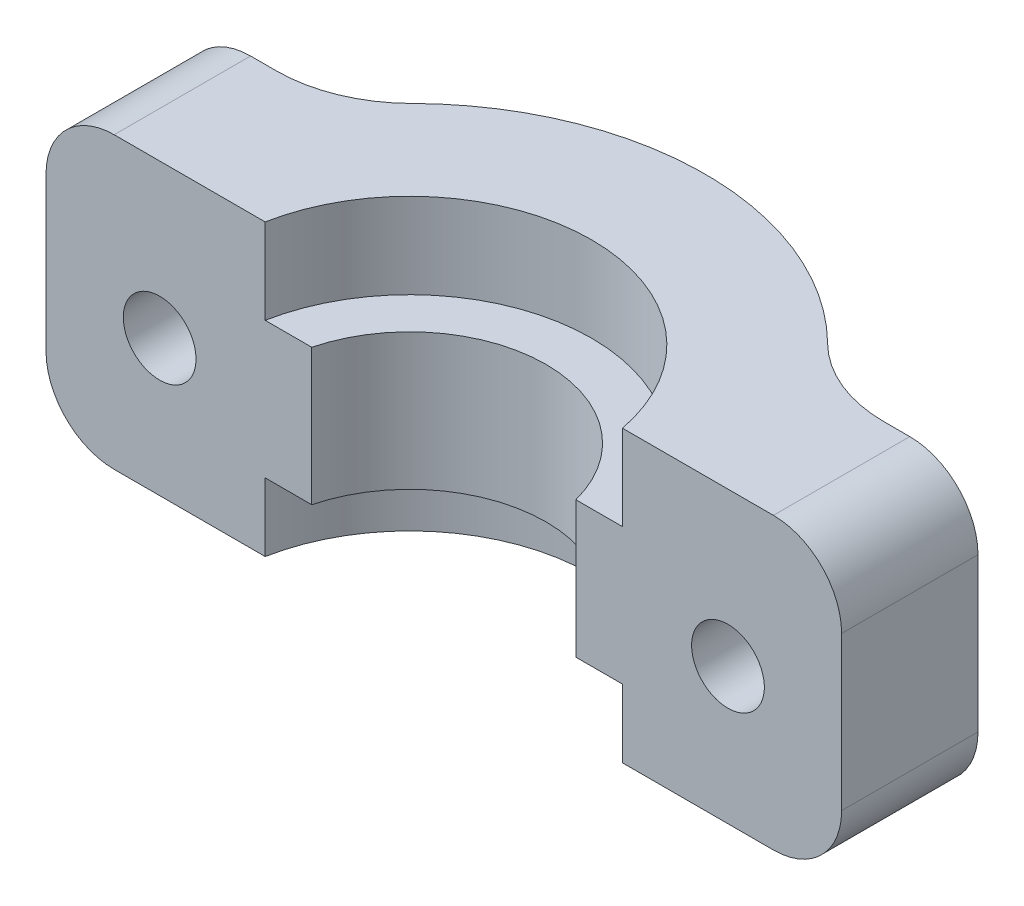
from build123d import *

# Parameters (mm, degrees)
BOSS_EXTRUDE1_DEPTH = 22
BOSS_EXTRUDE2_DEPTH = 22
SKETCH5_R           = 8
CUT_EXTRUDE5_DEPTH  = 3
CUT_EXTRUDE6_START  = -13
SKETCH6_R           = 8
CUT_EXTRUDE6_DEPTH  = 13
SKETCH8_R           = 2.55
CUT_EXTRUDE7_DEPTH  = 7
SKETCH7_W           = 44
SKETCH7_H           = 29.325472949
CUT_EXTRUDE8_DEPTH  = 9.25
FILLET1_R           = 6
SKETCH10_R          = 3.25
CUT_EXTRUDE9_DEPTH  = 58.619441164
SKETCH11_R          = 1.6
CUT_EXTRUDE10_DEPTH = 6
FILLET3_R           = 3


with BuildPart() as part:
    # Sketch2 → Boss-Extrude1 (new body)
    with BuildSketch(Plane(origin=(0, 0, 0), x_dir=(1, 0, 0), z_dir=(0, 1, 0))):
        with BuildLine():
            Line((0, 0), (44, 0))
            Line((44, 0), (44, 22.5))
            Line((44, 22.5), (23.5, 22.5))
            ThreePointArc((23.5, 22.5), (17.5, 16.5), (11.5, 22.5))
            Line((11.5, 22.5), (0, 22.5))
            Line((0, 22.5), (0, 0))
        make_face()
    extrude(amount=BOSS_EXTRUDE1_DEPTH)


with BuildPart() as body_2:
    # Sketch9 → Boss-Extrude2 (new body)
    with BuildSketch(Plane.XZ):
        with BuildLine():
            Line((11.690524981, -24), (0, -24))
            Line((0, -24), (0, -30))
            Line((0, -30), (6.881619709, -30))
            ThreePointArc((6.881619709, -30), (17.5, -35.5), (28.118380291, -30))
            Line((28.118380291, -30), (35, -30))
            Line((35, -30), (35, -24))
            Line((35, -24), (23.309475019, -24))
            ThreePointArc((23.309475019, -24), (17.5, -28.5), (11.690524981, -24))
        make_face()
    extrude(amount=-BOSS_EXTRUDE2_DEPTH)


with BuildPart() as cut_extrude5_tool:
    # Sketch5 → Cut-Extrude5 (new body)
    with BuildSketch(Plane.XZ):
        with Locations((17.5, -22.5)):
            Circle(SKETCH5_R)
    extrude(amount=-CUT_EXTRUDE5_DEPTH)


with BuildPart() as part_1:
    add(part.part)

    # Cut-Extrude5: cut by cut_extrude5_tool
    add(cut_extrude5_tool.part, mode=Mode.SUBTRACT)


with BuildPart() as body_2_1:
    add(body_2.part)

    # Cut-Extrude5: cut by cut_extrude5_tool
    add(cut_extrude5_tool.part, mode=Mode.SUBTRACT)


with BuildPart() as cut_extrude6_tool:
    # Sketch6 → Cut-Extrude6 (new body)
    with BuildSketch(Plane(origin=(0, 22, 0), x_dir=(1, 0, 0), z_dir=(0, 1, 0)).offset(CUT_EXTRUDE6_START)):
        with Locations((17.5, 22.5)):
            Circle(SKETCH6_R)
    extrude(amount=CUT_EXTRUDE6_DEPTH)


with BuildPart() as part_2:
    add(part_1.part)

    # Cut-Extrude6: cut by cut_extrude6_tool
    add(cut_extrude6_tool.part, mode=Mode.SUBTRACT)

    # Sketch8 → Cut-Extrude7 (cut)
    with BuildSketch(Plane(origin=(0, 0, -22.5), x_dir=(-1, 0, 0), z_dir=(0, 0, -1))):
        with Locations((-5, 6)):
            Circle(SKETCH8_R)
        with Locations(Location((-30, 6, 0), (0, 0, 180))):
            Circle(SKETCH8_R)
    extrude(amount=-CUT_EXTRUDE7_DEPTH, mode=Mode.SUBTRACT)


with BuildPart() as body_2_2:
    add(body_2_1.part)

    # Cut-Extrude6: cut by cut_extrude6_tool
    add(cut_extrude6_tool.part, mode=Mode.SUBTRACT)


with BuildPart() as cut_extrude8_tool:
    # Sketch7 → Cut-Extrude8 (new body)
    with BuildSketch(Plane.XZ.offset(-22)):
        with Locations((22, -23.662736475)):
            Rectangle(SKETCH7_W, SKETCH7_H)
    extrude(amount=CUT_EXTRUDE8_DEPTH)


with BuildPart() as part_3:
    add(part_2.part)

    # Cut-Extrude8: cut by cut_extrude8_tool
    add(cut_extrude8_tool.part, mode=Mode.SUBTRACT)


with BuildPart() as body_2_3:
    add(body_2_2.part)

    # Cut-Extrude8: cut by cut_extrude8_tool
    add(cut_extrude8_tool.part, mode=Mode.SUBTRACT)

    # Fillet1
    fillet1_edges = [body_2_3.edges().sort_by_distance(p)[0] for p in [
        (28.118380291, 6.375, -30),
        (6.881619709, 6.375, -30),
    ]]
    fillet(fillet1_edges, radius=FILLET1_R)

    # Sketch10 → Cut-Extrude9 (cut, through all)
    with BuildSketch(Plane(origin=(0, 0, -30), x_dir=(-1, 0, 0), z_dir=(0, 0, -1))):
        with Locations((-5, 6)):
            Circle(SKETCH10_R)
        with Locations((-30, 6)):
            Circle(SKETCH10_R)
    extrude(amount=CUT_EXTRUDE9_DEPTH, mode=Mode.SUBTRACT)

    # Sketch11 → Cut-Extrude10 (cut)
    with BuildSketch(Plane(origin=(0, 0, -30), x_dir=(-1, 0, 0), z_dir=(0, 0, -1))):
        with Locations((-5, 6)):
            Circle(SKETCH11_R)
        with Locations((-30, 6)):
            Circle(SKETCH11_R)
    extrude(amount=-CUT_EXTRUDE10_DEPTH, mode=Mode.SUBTRACT)

    # Fillet3
    fillet3_edges = [body_2_3.edges().sort_by_distance(p)[0] for p in [
        (0, 0, -27),
        (35, 0, -27),
        (35, 12.75, -27),
        (0, 12.75, -27),
    ]]
    fillet(fillet3_edges, radius=FILLET3_R)


solid = body_2_3.part
